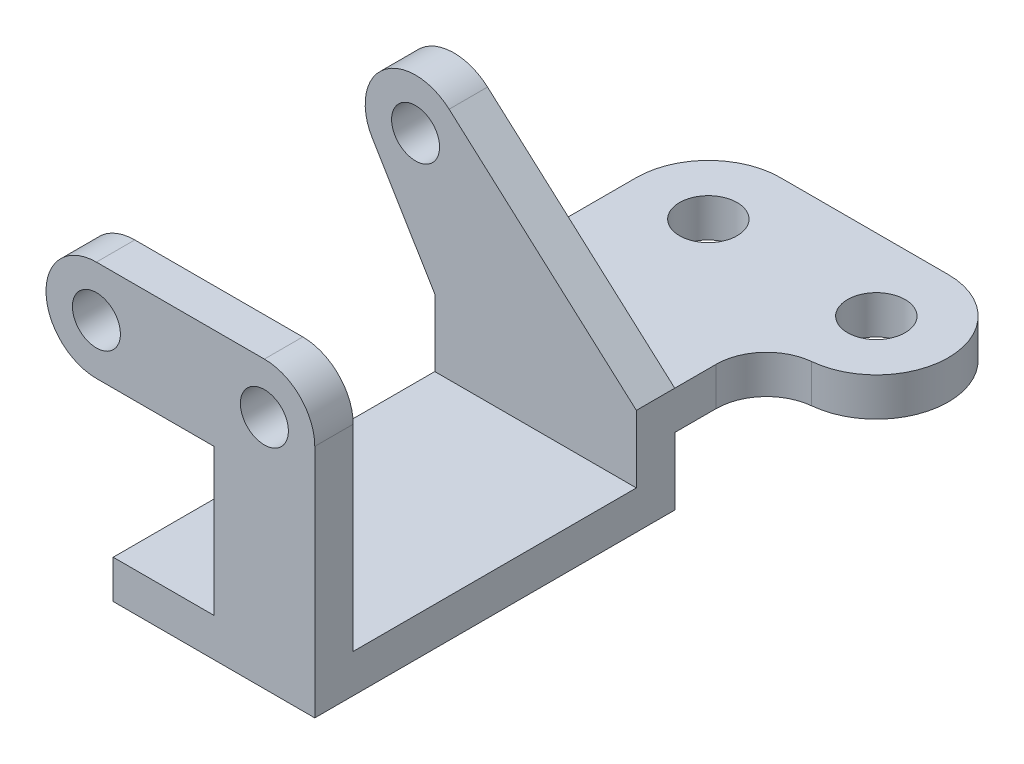
from build123d import *

# Parameters (mm, degrees)
BOSS_EXTRUDE1_DEPTH = 42
BOSS_EXTRUDE3_DEPTH = 16
SKETCH7_R           = 10
CUT_EXTRUDE2_DEPTH  = 16
BOSS_EXTRUDE4_DEPTH = 16
SKETCH9_R           = 12
CUT_EXTRUDE3_DEPTH  = 16
FILLET1_R           = 21
BOSS_EXTRUDE5_DEPTH = 16
SKETCH12_R          = 10
CUT_EXTRUDE5_DEPTH  = 16


with BuildPart() as part:
    # Sketch2 → Boss-Extrude1 (new, symmetric)
    with BuildSketch(Plane(origin=(0, 0, 0), x_dir=(0, 0, -1), z_dir=(1, 0, 0))):
        Polygon((0, 0), (-134, 0), (-134, -16), (16, -16), (16, 12), (84, 12), (84, 28), (0, 28), align=None)
    extrude(amount=BOSS_EXTRUDE1_DEPTH, both=True)

    # Sketch6 → Boss-Extrude3 (add)
    with BuildSketch(Plane.XY):
        with BuildLine():
            Line((-67.990788091, 71.168031394), (-42, 28))
            Line((-42, 28), (42, 28))
            Line((42, 28), (-36.012593074, 97.663730318))
            ThreePointArc((-36.012593074, 97.663730318), (-63.398219306, 98.170581914), (-67.990788091, 71.168031394))
        make_face()
    extrude(amount=-BOSS_EXTRUDE3_DEPTH)

    # Sketch7 → Cut-Extrude2 (cut)
    with BuildSketch(Plane.XY):
        with Locations((-50, 82)):
            Circle(SKETCH7_R)
    extrude(amount=-CUT_EXTRUDE2_DEPTH, mode=Mode.SUBTRACT)

    # Sketch8 → Boss-Extrude4 (add)
    with BuildSketch(Plane(origin=(0, 28, 0), x_dir=(1, 0, 0), z_dir=(0, 1, 0))):
        with BuildLine():
            Line((-12, 114), (58, 114))
            ThreePointArc((58, 114), (88, 84), (58, 54))
            Line((58, 54), (-12, 54))
            ThreePointArc((-12, 54), (-42, 84), (-12, 114))
        make_face()
    extrude(amount=-BOSS_EXTRUDE4_DEPTH)

    # Sketch9 → Cut-Extrude3 (cut)
    with BuildSketch(Plane(origin=(0, 28, 0), x_dir=(1, 0, 0), z_dir=(0, 1, 0))):
        with Locations(Location((-12, 84, 0), (0, 0, 270))):
            Circle(SKETCH9_R)
        with Locations(Location((58, 84, 0), (0, 0, 270))):
            Circle(SKETCH9_R)
    extrude(amount=-CUT_EXTRUDE3_DEPTH, mode=Mode.SUBTRACT)

    # Fillet1
    fillet1_edges = [part.edges().sort_by_distance(p)[0] for p in [
        (42, 20, -54),
    ]]
    fillet(fillet1_edges, radius=FILLET1_R)

    # Sketch11 → Boss-Extrude5 (add)
    with BuildSketch(Plane.XY.offset(134)):
        with BuildLine():
            Line((0, 61), (0, 0))
            Line((0, 0), (42, 0))
            Line((42, 0), (42, 82))
            ThreePointArc((42, 82), (35.849242405, 96.849242405), (21, 103))
            Line((21, 103), (-49, 103))
            ThreePointArc((-49, 103), (-70, 82), (-49, 61))
            Line((-49, 61), (0, 61))
        make_face()
    extrude(amount=-BOSS_EXTRUDE5_DEPTH)

    # Sketch12 → Cut-Extrude5 (cut)
    with BuildSketch(Plane.XY.offset(134)):
        with Locations((-49, 82)):
            Circle(SKETCH12_R)
        with Locations((21, 82)):
            Circle(SKETCH12_R)
    extrude(amount=-CUT_EXTRUDE5_DEPTH, mode=Mode.SUBTRACT)


solid = part.part
